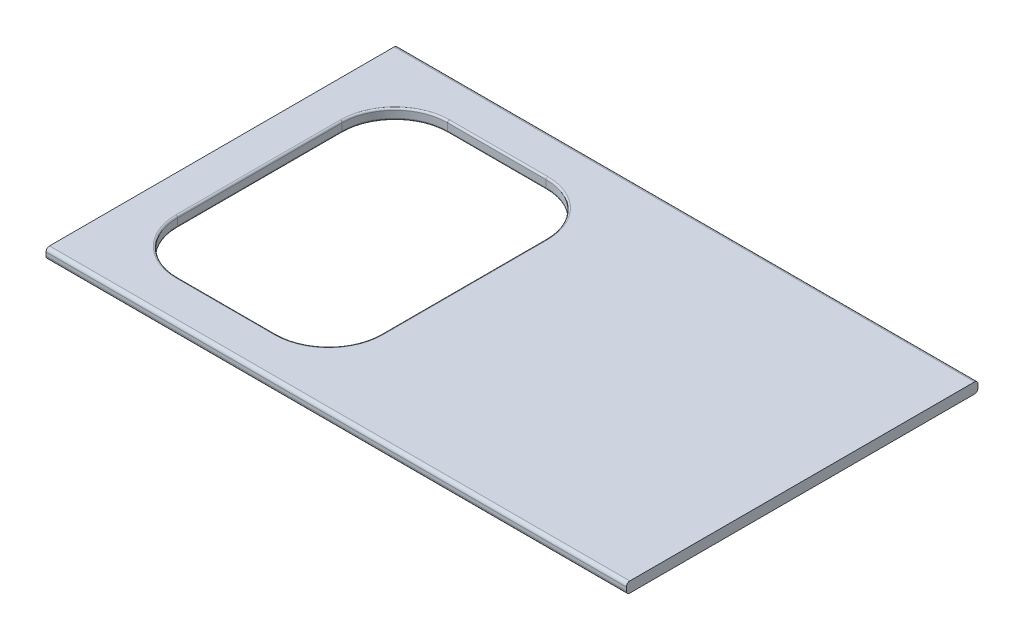
from build123d import *

# Parameters (mm, degrees)
SKETCH_1_W          = 165
SKETCH_1_H          = 100
EXTRUDE_1_DEPTH     = 3
SKETCH_2_W          = 57.969471509
SKETCH_2_H          = 76.82290634
CUT_EXTRUDE_1_DEPTH = 97.51554279
FILLET_1_R          = 15
FILLET_2_R          = 1
FILLET_3_R          = 0.5


with BuildPart() as part:
    # 草图1 → 凸台-拉伸1 (new body)
    with BuildSketch(Plane(origin=(0, 0, 0), x_dir=(1, 0, 0), z_dir=(0, 1, 0))):
        Rectangle(SKETCH_1_W, SKETCH_1_H)
    extrude(amount=EXTRUDE_1_DEPTH)

    # 草图2 → 切除-拉伸1 (cut, through all)
    with BuildSketch(Plane.XZ):
        with Locations((-42.70408642, 0)):
            Rectangle(SKETCH_2_W, SKETCH_2_H)
    extrude(amount=-CUT_EXTRUDE_1_DEPTH, mode=Mode.SUBTRACT)

    # 圆角1
    fillet_1_edges = [part.edges().sort_by_distance(p)[0] for p in [
        (-13.719350665, 1.5, 38.41145317),
        (-13.719350665, 1.5, -38.41145317),
        (-71.688822174, 1.5, -38.41145317),
        (-71.688822174, 1.5, 38.41145317),
    ]]
    fillet(fillet_1_edges, radius=FILLET_1_R)

    # 圆角2
    fillet_2_edges = [part.edges().sort_by_distance(p)[0] for p in [
        (0, 3, 50),
        (0, 0, 50),
        (0, 0, -50),
        (0, 3, -50),
    ]]
    fillet(fillet_2_edges, radius=FILLET_2_R)

    # 圆角3
    fillet_3_edges = [part.edges().sort_by_distance(p)[0] for p in [
        (-42.704086419, 0, -38.41145317),
        (-42.704086419, 3, -38.41145317),
        (-71.688822174, 0, 0),
        (-71.688822174, 3, 0),
        (-42.704086419, 0, 38.41145317),
        (-42.704086419, 3, 38.41145317),
        (-13.719350665, 0, 0),
        (-13.719350665, 3, 0),
        (-67.295423892, 0, -34.018054888),
        (-67.295423892, 3, -34.018054888),
        (-67.295423892, 0, 34.018054888),
        (-67.295423892, 3, 34.018054888),
        (-18.112748947, 0, -34.018054888),
        (-18.112748947, 3, -34.018054888),
        (-18.112748947, 0, 34.018054888),
        (-18.112748947, 3, 34.018054888),
    ]]
    fillet(fillet_3_edges, radius=FILLET_3_R)


solid = part.part
